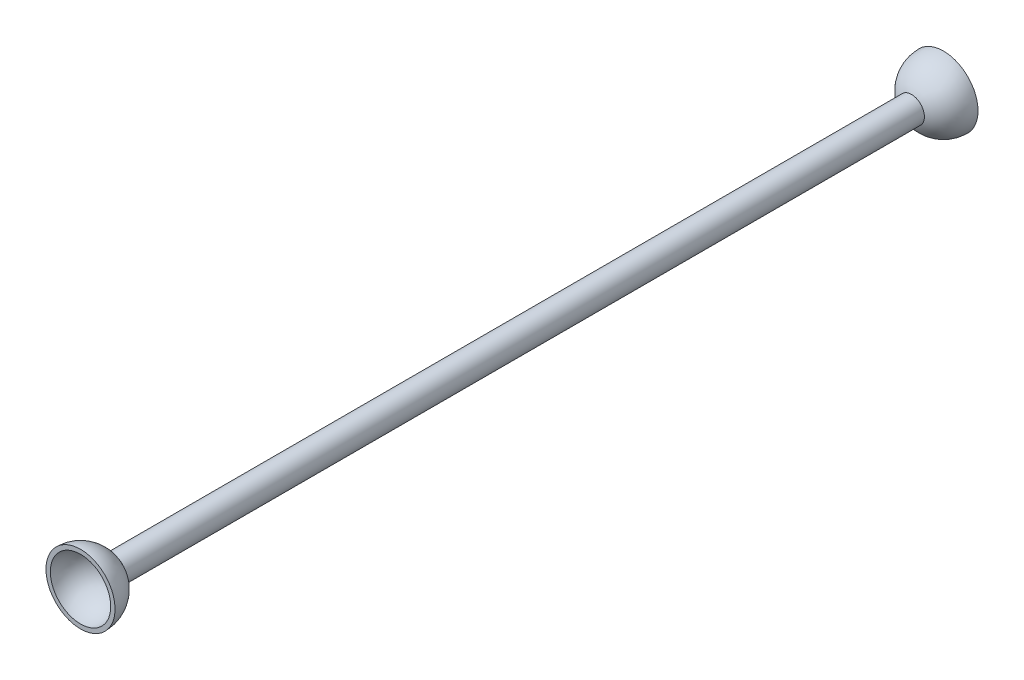
from build123d import *

# Parameters (mm, degrees)
SKETCH1_R           = 3
BOSS_EXTRUDE1_DEPTH = 200
REVOLVE1_ANGLE      = 180
REVOLVE2_ANGLE      = 180


with BuildPart() as part:
    # Sketch1 → Boss-Extrude1 (new body)
    with BuildSketch(Plane.XY):
        Circle(SKETCH1_R)
    extrude(amount=BOSS_EXTRUDE1_DEPTH)

    # Sketch2 → Revolve1 (revolve)
    with BuildSketch(Plane.XY.offset(200)):
        with BuildLine():
            Line((0, 8), (0, 7))
            Line((0, 7), (0, -7))
            Line((0, -7), (0, -8))
            ThreePointArc((0, -8), (8, 0), (0, 8))
        make_face()
    revolve(axis=Axis((0, 8, 200), (0, 1, 0)), revolution_arc=REVOLVE1_ANGLE)

    # Sketch3 → Cut-Revolve1 (revolve, cut)
    with BuildSketch(Plane.XY.offset(200)):
        with BuildLine():
            Line((0, 7), (0, -7))
            ThreePointArc((0, -7), (7, 0), (0, 7))
        make_face()
    revolve(axis=Axis((0, 7, 200), (0, -1, 0)), mode=Mode.SUBTRACT)

    # Sketch4 → Revolve2 (revolve)
    with BuildSketch(Plane(origin=(0, 0, 0), x_dir=(-1, 0, 0), z_dir=(0, 0, -1))):
        with BuildLine():
            Line((0, 8), (0, -8))
            ThreePointArc((0, -8), (8, 0), (0, 8))
        make_face()
    revolve(axis=Axis((0, 8, 0), (0, 1, 0)), revolution_arc=REVOLVE2_ANGLE)

    # Sketch5 → Cut-Revolve2 (revolve, cut)
    with BuildSketch(Plane(origin=(0, 0, 0), x_dir=(-1, 0, 0), z_dir=(0, 0, -1))):
        with BuildLine():
            Line((0, 7), (0, -7))
            ThreePointArc((0, -7), (7, 0), (0, 7))
        make_face()
    revolve(axis=Axis((0, 7, 0), (0, -1, 0)), mode=Mode.SUBTRACT)


solid = part.part
